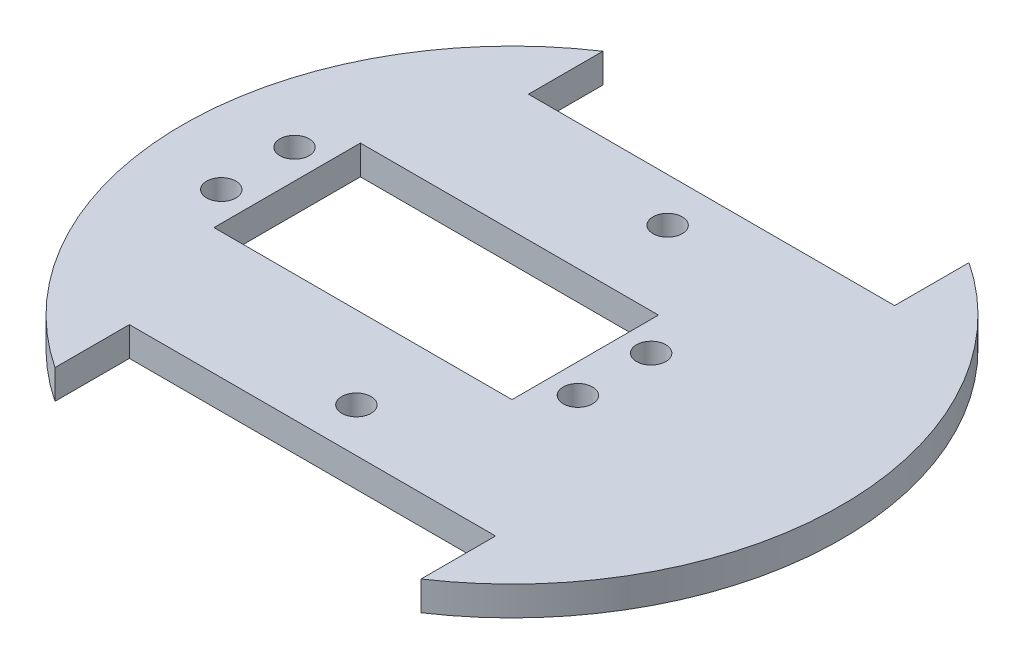
from build123d import *

# Parameters (mm, degrees)
ESTRUSIONE_ESTRUSIONE1_DEPTH = 2
CROQUIS2_R                   = 2
CROQUIS2_W                   = 40.7
CROQUIS2_H                   = 20
CORTAR_EXTRUIR1_DEPTH        = 59.660037504


with BuildPart() as part:
    # Schizzo1 → Estrusione-Estrusione1 (new, symmetric)
    with BuildSketch(Plane(origin=(0, 0, 0), x_dir=(1, 0, 0), z_dir=(0, 1, 0))):
        with BuildLine():
            Line((-25, 37.416573868), (-25, 27.25))
            Line((-25, 27.25), (25, 27.25))
            Line((25, 27.25), (25, 37.416573868))
            ThreePointArc((25, 37.416573868), (45, 0), (25, -37.416573868))
            Line((25, -37.416573868), (25, -27.25))
            Line((25, -27.25), (-25, -27.25))
            Line((-25, -27.25), (-25, -37.416573868))
            ThreePointArc((-25, -37.416573868), (-45, 0), (-25, 37.416573868))
        make_face()
    extrude(amount=ESTRUSIONE_ESTRUSIONE1_DEPTH, both=True)

    # Croquis2 → Cortar-Extruir1 (cut, through all)
    with BuildSketch(Plane(origin=(0, 2, 0), x_dir=(1, 0, 0), z_dir=(0, 1, 0))):
        with Locations(Location((-34.7, 5, 0), (0, 0, 270))):
            Circle(CROQUIS2_R)
        with Locations(Location((-34.7, -5, 0), (0, 0, 270))):
            Circle(CROQUIS2_R)
        with Locations(Location((14, 5, 0), (0, 0, 270))):
            Circle(CROQUIS2_R)
        with Locations(Location((14, -5, 0), (0, 0, 270))):
            Circle(CROQUIS2_R)
        with Locations(Location((0, 21.25, 0), (0, 0, 270))):
            Circle(CROQUIS2_R)
        with Locations(Location((0, -21.25, 0), (0, 0, 270))):
            Circle(CROQUIS2_R)
        with Locations((-10.35, 0)):
            Rectangle(CROQUIS2_W, CROQUIS2_H)
    extrude(amount=-CORTAR_EXTRUIR1_DEPTH, mode=Mode.SUBTRACT)


solid = part.part
